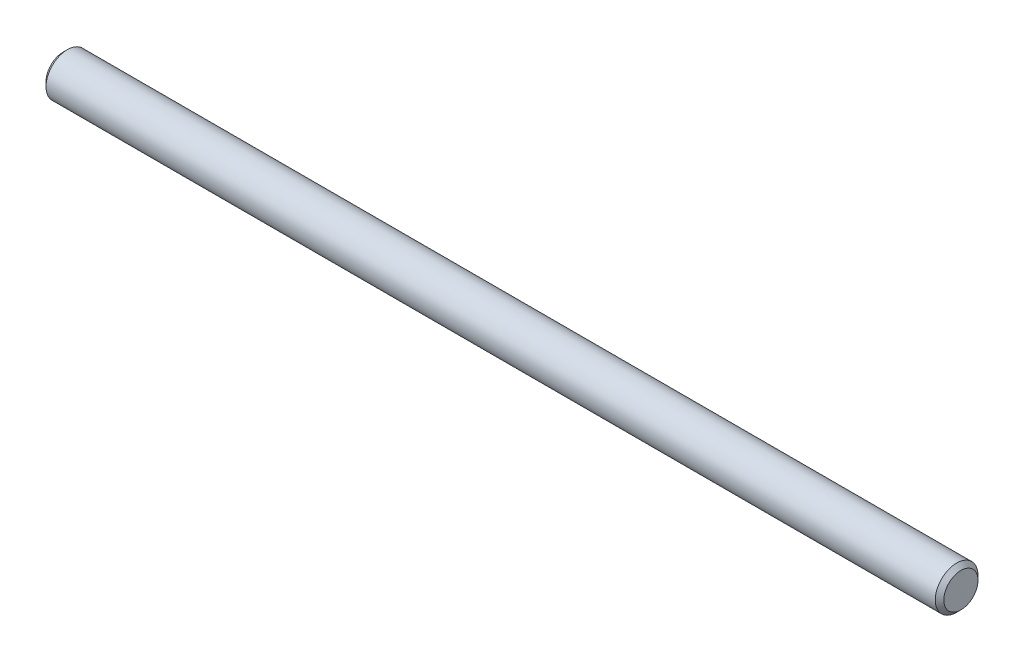
from build123d import *

# Parameters (mm, degrees)
SKIZZE1_R                       = 1
AUFSATZ_LINEAR_AUSTRAGEN1_DEPTH = 42
FASE1_SIZE                      = 0.2


with BuildPart() as part:
    # Skizze1 → Aufsatz-Linear austragen1 (new body)
    with BuildSketch(Plane(origin=(0, 0, 0), x_dir=(0, 0, -1), z_dir=(1, 0, 0))):
        with Locations(Location((0, 0, 0), (0, 0, 180))):
            Circle(SKIZZE1_R)
    extrude(amount=AUFSATZ_LINEAR_AUSTRAGEN1_DEPTH)

    # Fase1
    fase1_edges = [part.edges().sort_by_distance(p)[0] for p in [
        (0, 0, -1),
        (42, 0, -1),
    ]]
    chamfer(fase1_edges, length=FASE1_SIZE)


solid = part.part
